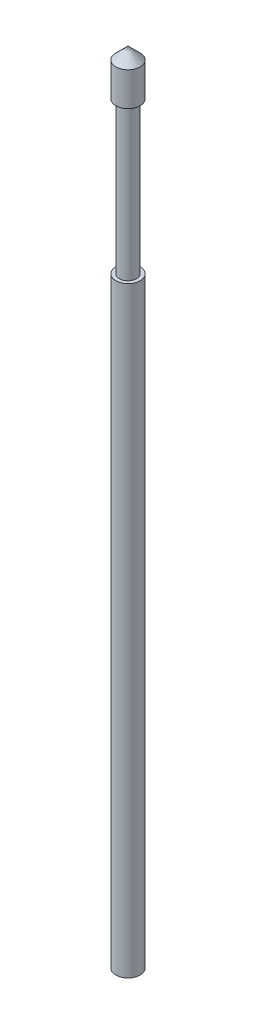
from build123d import *

# Parameters (mm, degrees)
SKETCH1_R           = 0.505
BOSS_EXTRUDE1_DEPTH = 25
SKETCH2_R           = 0.36
BOSS_EXTRUDE2_DEPTH = 6.3
SKETCH3_R           = 0.505
BOSS_EXTRUDE3_DEPTH = 1.4


with BuildPart() as part:
    # Sketch1 → Boss-Extrude1 (new body)
    with BuildSketch(Plane(origin=(0, 0, 0), x_dir=(1, 0, 0), z_dir=(0, 1, 0))):
        with Locations(Location((0, 0, 0), (0, 0, 270))):
            Circle(SKETCH1_R)
    extrude(amount=BOSS_EXTRUDE1_DEPTH)

    # Sketch2 → Boss-Extrude2 (add)
    with BuildSketch(Plane(origin=(0, 25, 0), x_dir=(1, 0, 0), z_dir=(0, 1, 0))):
        with Locations(Location((0, 0, 0), (0, 0, 270))):
            Circle(SKETCH2_R)
    extrude(amount=BOSS_EXTRUDE2_DEPTH)

    # Sketch3 → Boss-Extrude3 (add)
    with BuildSketch(Plane(origin=(0, 31.3, 0), x_dir=(1, 0, 0), z_dir=(0, 1, 0))):
        with Locations(Location((0, 0, 0), (0, 0, 270))):
            Circle(SKETCH3_R)
    extrude(amount=BOSS_EXTRUDE3_DEPTH)

    # Sketch4 → Revolve1 (revolve)
    with BuildSketch(Plane.XY, mode=Mode.PRIVATE) as revolve1_sk:
        Polygon((0, 32.7), (0, 33.2), (0.505, 32.7), align=None)
    revolve(revolve1_sk.sketch.rotate(Axis((0, 32.7, 0), (0, 1, 0)), 90), axis=Axis((0, 32.7, 0), (0, 1, 0)))


solid = part.part
